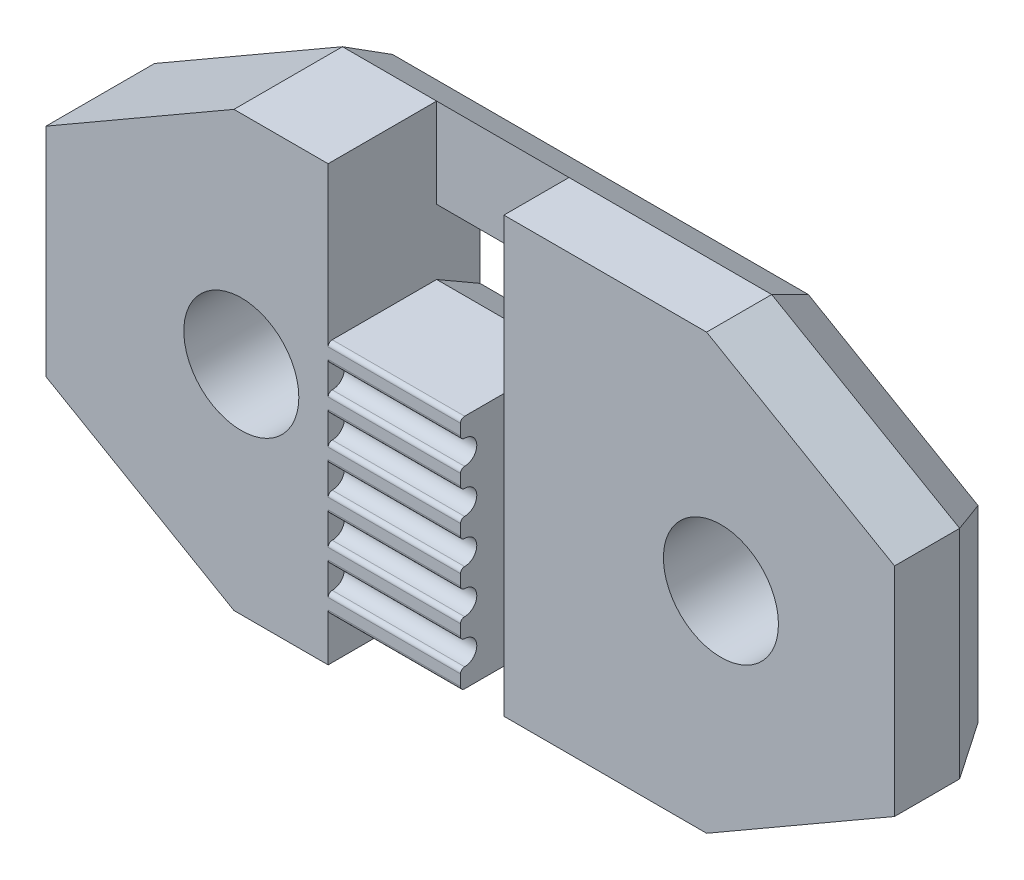
from build123d import *
from OCP.BRepFilletAPI import BRepFilletAPI_MakeChamfer

# Parameters (mm, degrees)
AUFSATZ_LINEAR_AUSTRAGEN1_DEPTH    = 6.1
AUFSATZ_LINEAR_AUSTRAGEN1_2_DEPTH  = 6.1
SKIZZE2_W                          = 6
SKIZZE2_H                          = 10.88
SCHNITT_LINEAR_AUSTRAGEN1_DEPTH    = 6.1
SKIZZE3_R                          = 2.65
SKIZZE3_W                          = 6.1
SKIZZE3_H                          = 4.12
AUFSATZ_LINEAR_AUSTRAGEN2_DEPTH    = 2.19
SKIZZE4_R                          = 2.65
AUFSATZ_LINEAR_AUSTRAGEN3_DEPTH    = 4.81
SKIZZE5_R                          = 2.65
AUFSATZ_LINEAR_AUSTRAGEN4_DEPTH    = 0.19
FASE1_SIZE                         = 5
FASE1_SIZE2                        = 8.660254038
FASE2_SIZE                         = 2
FASE2_SIZE2                        = 1.154700538
SCHNITT_LINEAR_START               = -4
SCHNITT_LINEAR_AUSTRAGEN3_DEPTH    = 2.5
SCHNITT_LINEAR_AUSTRAGEN4_REACH    = 67.9
SKIZZE12_W                         = 5
SKIZZE12_H                         = 6.1
K_RPER_VERSCHIEBEN_KOPIEREN1_ANGLE = 90


with BuildPart() as part:
    # Skizze1 → Aufsatz-Linear austragen1 (new body)
    with BuildSketch(Plane.XY):
        Polygon((0, 0), (0, 9.44), (0, 10.88), (-6, 10.88), (-6, 0), align=None)
    extrude(amount=AUFSATZ_LINEAR_AUSTRAGEN1_DEPTH)

    # Skizze2 → Schnitt-Linear austragen1 (cut)
    with BuildSketch(Plane.XY.offset(6.1)):
        with Locations((-3, 5.44)):
            Rectangle(SKIZZE2_W, SKIZZE2_H)
    extrude(amount=-SCHNITT_LINEAR_AUSTRAGEN1_DEPTH, mode=Mode.SUBTRACT)


with BuildPart() as body_2:
    # Skizze1 → Aufsatz-Linear austragen1 2 (new body)
    with BuildSketch(Plane.XY):
        with BuildLine():
            Line((-7.05, 10.19), (-7.05, 10.69))
            ThreePointArc((-7.05, 10.69), (-7.105649712, 10.824350288), (-7.24, 10.88))
            Line((-7.24, 10.88), (-9.24, 10.88))
            Line((-9.24, 10.88), (-9.24, 0))
            Line((-9.24, 0), (-7.24, 0))
            ThreePointArc((-7.24, 0), (-7.105649712, 0.055649712), (-7.05, 0.19))
            Line((-7.05, 0.19), (-7.05, 0.69))
            ThreePointArc((-7.05, 0.69), (-7.105649712, 0.824350288), (-7.24, 0.88))
            ThreePointArc((-7.24, 0.88), (-7.8, 1.44), (-7.24, 2))
            ThreePointArc((-7.24, 2), (-7.105649712, 2.055649712), (-7.05, 2.19))
            Line((-7.05, 2.19), (-7.05, 2.69))
            ThreePointArc((-7.05, 2.69), (-7.105649712, 2.824350288), (-7.24, 2.88))
            ThreePointArc((-7.24, 2.88), (-7.8, 3.44), (-7.24, 4))
            ThreePointArc((-7.24, 4), (-7.105649712, 4.055649712), (-7.05, 4.19))
            Line((-7.05, 4.19), (-7.05, 4.69))
            ThreePointArc((-7.05, 4.69), (-7.105649712, 4.824350288), (-7.24, 4.88))
            ThreePointArc((-7.24, 4.88), (-7.8, 5.44), (-7.24, 6))
            ThreePointArc((-7.24, 6), (-7.105649712, 6.055649712), (-7.05, 6.19))
            Line((-7.05, 6.19), (-7.05, 6.69))
            ThreePointArc((-7.05, 6.69), (-7.105649712, 6.824350288), (-7.24, 6.88))
            ThreePointArc((-7.24, 6.88), (-7.8, 7.44), (-7.24, 8))
            ThreePointArc((-7.24, 8), (-7.105649712, 8.055649712), (-7.05, 8.19))
            Line((-7.05, 8.19), (-7.05, 8.69))
            ThreePointArc((-7.05, 8.69), (-7.105649712, 8.824350288), (-7.24, 8.88))
            ThreePointArc((-7.24, 8.88), (-7.8, 9.44), (-7.24, 10))
            ThreePointArc((-7.24, 10), (-7.105649712, 10.055649712), (-7.05, 10.19))
        make_face()
    extrude(amount=AUFSATZ_LINEAR_AUSTRAGEN1_2_DEPTH)

    # Skizze3 → Aufsatz-Linear austragen2 (add)
    # profile 1 of 2: a face of its own
    with BuildSketch(Plane.ZY.offset(9.24)):
        Polygon((-13, -2), (0, -2), (0, 13.88), (0, 18), (-13, 18), align=None)
        with Locations((-4, 8)):
            Circle(SKIZZE3_R, mode=Mode.SUBTRACT)
    # profile 2 of 2: a face of its own
    with BuildSketch(Plane.ZY.offset(9.24)):
        with Locations((3.05, 15.94)):
            Rectangle(SKIZZE3_W, SKIZZE3_H)
    extrude(amount=-AUFSATZ_LINEAR_AUSTRAGEN2_DEPTH)

    # Skizze4 → Aufsatz-Linear austragen3 (add)
    # profile 1 of 2: a face of its own
    with BuildSketch(Plane.ZY.offset(9.24)):
        Polygon((24.1, 18), (6.1, 18), (6.1, 13.88), (6.1, 10.88), (6.1, 0), (6.1, -2), (24.1, -2), align=None)
        with Locations((16.1, 8)):
            Circle(SKIZZE4_R, mode=Mode.SUBTRACT)
    # profile 2 of 2: a face of its own
    with BuildSketch(Plane.ZY.offset(9.24)):
        Polygon((6.1, 0), (6.1, 10.88), (0, 10.88), (0, 13.88), (6.1, 13.88), (6.1, 18), (-13, 18), (-13, -2), (0, -2), (0, 0), align=None)
        with Locations((-4, 8)):
            Circle(SKIZZE4_R, mode=Mode.SUBTRACT)
    extrude(amount=AUFSATZ_LINEAR_AUSTRAGEN3_DEPTH)

    # Skizze5 → Aufsatz-Linear austragen4 (add)
    with BuildSketch(Plane(origin=(-9.24, 0, 0), x_dir=(0, 0, -1), z_dir=(1, 0, 0))):
        Polygon((-6.1, 13.88), (-6.1, 18), (-24.1, 18), (-24.1, -2), (-6.1, -2), (-6.1, 0), (-6.1, 10.88), align=None)
        with Locations(Location((-16.1, 8, 0), (0, 0, 180))):
            Circle(SKIZZE5_R, mode=Mode.SUBTRACT)
    extrude(amount=AUFSATZ_LINEAR_AUSTRAGEN4_DEPTH)

    # Fase1: one chamfer whose edges measure the first distance from different faces: ONE call of the kernel's chamfer builder (chamfer() names one face for all edges)
    fase1_edges_1 = [body_2.edges().sort_by_distance(p)[0] for p in [
        (-11.645, -2, 24.1),
        (-11.645, 18, 24.1),
    ]]
    fase1_side_1 = [body_2.faces().sort_by_distance(p)[0] for p in [
        (-11.645, 8, 24.1),
    ]]
    fase1_edges_2 = [body_2.edges().sort_by_distance(p)[0] for p in [
        (-10.55, -2, -13),
        (-10.55, 18, -13),
    ]]
    fase1_side_2 = [body_2.faces().sort_by_distance(p)[0] for p in [
        (-10.55, 8, -13),
    ]]
    fase1 = BRepFilletAPI_MakeChamfer(body_2.part.solid().wrapped)
    for e in fase1_edges_1:
        fase1.Add(FASE1_SIZE, FASE1_SIZE2, e.wrapped, fase1_side_1[0].wrapped)  # the first distance lies on this face
    for e in fase1_edges_2:
        fase1.Add(FASE1_SIZE, FASE1_SIZE2, e.wrapped, fase1_side_2[0].wrapped)  # the first distance lies on this face
    add(Compound.cast(fase1.Shape()), mode=Mode.REPLACE)

    # Fase2: one chamfer whose edges measure the first distance from different faces: ONE call of the kernel's chamfer builder (chamfer() names one face for all edges)
    fase2_edges_1 = [body_2.edges().sort_by_distance(p)[0] for p in [
        (-14.05, -2, 10.769872981),
    ]]
    fase2_side_1 = [body_2.faces().sort_by_distance(p)[0] for p in [
        (-11.645, -2, 10.769872981),
    ]]
    fase2_edges_2 = [body_2.edges().sort_by_distance(p)[0] for p in [
        (-14.05, 10.88, 3.05),
    ]]
    fase2_side_2 = [body_2.faces().sort_by_distance(p)[0] for p in [
        (-11.645, 10.88, 3.05),
    ]]
    fase2_edges_3 = [body_2.edges().sort_by_distance(p)[0] for p in [
        (-14.05, 13.88, 3.05),
    ]]
    fase2_side_3 = [body_2.faces().sort_by_distance(p)[0] for p in [
        (-10.55, 13.88, 3.05),
    ]]
    fase2_edges_4 = [body_2.edges().sort_by_distance(p)[0] for p in [
        (-14.05, 18, 5.55),
    ]]
    fase2_side_4 = [body_2.faces().sort_by_distance(p)[0] for p in [
        (-10.939880768, 18, 4.735948766),
    ]]
    fase2_edges_5 = [body_2.edges().sort_by_distance(p)[0] for p in [
        (-14.05, 8, 24.1),
    ]]
    fase2_side_5 = [body_2.faces().sort_by_distance(p)[0] for p in [
        (-11.645, 8, 24.1),
    ]]
    fase2_edges_6 = [body_2.edges().sort_by_distance(p)[0] for p in [
        (-14.05, 8, -13),
    ]]
    fase2_side_6 = [body_2.faces().sort_by_distance(p)[0] for p in [
        (-10.55, 8, -13),
    ]]
    fase2_edges_7 = [body_2.edges().sort_by_distance(p)[0] for p in [
        (-14.05, -2, -2.169872981),
    ]]
    fase2_side_7 = [body_2.faces().sort_by_distance(p)[0] for p in [
        (-10.55, -2, -2.169872981),
    ]]
    fase2_edges_8 = [body_2.edges().sort_by_distance(p)[0] for p in [
        (-14.05, 0.5, -8.669872981),
    ]]
    fase2_side_8 = [body_2.faces().sort_by_distance(p)[0] for p in [
        (-10.55, 0.5, -8.669872981),
    ]]
    fase2_edges_9 = [body_2.edges().sort_by_distance(p)[0] for p in [
        (-14.05, 0.5, 19.769872981),
    ]]
    fase2_side_9 = [body_2.faces().sort_by_distance(p)[0] for p in [
        (-11.645, 0.5, 19.769872981),
    ]]
    fase2_edges_10 = [body_2.edges().sort_by_distance(p)[0] for p in [
        (-14.05, 15.5, 19.769872981),
    ]]
    fase2_side_10 = [body_2.faces().sort_by_distance(p)[0] for p in [
        (-11.645, 15.5, 19.769872981),
    ]]
    fase2_edges_11 = [body_2.edges().sort_by_distance(p)[0] for p in [
        (-14.05, 15.5, -8.669872981),
    ]]
    fase2_side_11 = [body_2.faces().sort_by_distance(p)[0] for p in [
        (-10.55, 15.5, -8.669872981),
    ]]
    fase2 = BRepFilletAPI_MakeChamfer(body_2.part.solid().wrapped)
    for e in fase2_edges_1:
        fase2.Add(FASE2_SIZE, FASE2_SIZE2, e.wrapped, fase2_side_1[0].wrapped)  # the first distance lies on this face
    for e in fase2_edges_2:
        fase2.Add(FASE2_SIZE, FASE2_SIZE2, e.wrapped, fase2_side_2[0].wrapped)  # the first distance lies on this face
    for e in fase2_edges_3:
        fase2.Add(FASE2_SIZE, FASE2_SIZE2, e.wrapped, fase2_side_3[0].wrapped)  # the first distance lies on this face
    for e in fase2_edges_4:
        fase2.Add(FASE2_SIZE, FASE2_SIZE2, e.wrapped, fase2_side_4[0].wrapped)  # the first distance lies on this face
    for e in fase2_edges_5:
        fase2.Add(FASE2_SIZE, FASE2_SIZE2, e.wrapped, fase2_side_5[0].wrapped)  # the first distance lies on this face
    for e in fase2_edges_6:
        fase2.Add(FASE2_SIZE, FASE2_SIZE2, e.wrapped, fase2_side_6[0].wrapped)  # the first distance lies on this face
    for e in fase2_edges_7:
        fase2.Add(FASE2_SIZE, FASE2_SIZE2, e.wrapped, fase2_side_7[0].wrapped)  # the first distance lies on this face
    for e in fase2_edges_8:
        fase2.Add(FASE2_SIZE, FASE2_SIZE2, e.wrapped, fase2_side_8[0].wrapped)  # the first distance lies on this face
    for e in fase2_edges_9:
        fase2.Add(FASE2_SIZE, FASE2_SIZE2, e.wrapped, fase2_side_9[0].wrapped)  # the first distance lies on this face
    for e in fase2_edges_10:
        fase2.Add(FASE2_SIZE, FASE2_SIZE2, e.wrapped, fase2_side_10[0].wrapped)  # the first distance lies on this face
    for e in fase2_edges_11:
        fase2.Add(FASE2_SIZE, FASE2_SIZE2, e.wrapped, fase2_side_11[0].wrapped)  # the first distance lies on this face
    add(Compound.cast(fase2.Shape()), mode=Mode.REPLACE)

    # Skizze11 → Schnitt-Linear austragen3 (cut)
    with BuildSketch(Plane.XZ.offset(2).offset(SCHNITT_LINEAR_START)):
        with BuildLine():
            Line((-14.05, 7.6), (-14.05, 6.1))
            ThreePointArc((-14.05, 6.1), (-12.989339828, 5.660660172), (-12.55, 4.6))
            Line((-12.55, 4.6), (-12.55, 1.5))
            ThreePointArc((-12.55, 1.5), (-12.989339828, 0.439339828), (-14.05, 0))
            Line((-14.05, 0), (-14.05, -1.5))
            ThreePointArc((-14.05, -1.5), (-11.928679656, -0.621320344), (-11.05, 1.5))
            Line((-11.05, 1.5), (-11.05, 4.6))
            ThreePointArc((-11.05, 4.6), (-11.928679656, 6.721320344), (-14.05, 7.6))
        make_face()
    extrude(amount=-SCHNITT_LINEAR_AUSTRAGEN3_DEPTH, mode=Mode.SUBTRACT)


with BuildPart() as body_2_2:
    # Spiegeln1: mirrored copy
    add(body_2.part.mirror(Plane(origin=(-63.197479165, -24.924466517, 24.1), x_dir=(1, 0, 0), z_dir=(0, 0, 1))))

    # Schnitt-Linear austragen4: up to this plane
    schnitt_linear_austragen4_end = Plane(origin=(-14.05, 15.034700538, 42.1), z_dir=(0.4999999999999981, 0.8660254037844397, 0))
    # Skizze12 → Schnitt-Linear austragen4 (cut, up to the surface)
    with BuildSketch(Plane(origin=(0, 18, 0), x_dir=(1, 0, 0), z_dir=(0, 1, 0)), mode=Mode.PRIVATE) as schnitt_linear_austragen4_sk1:
        with Locations((-9.55, -45.15)):
            Rectangle(SKIZZE12_W, SKIZZE12_H)
    schnitt_linear_austragen4_tool1 = split(extrude(schnitt_linear_austragen4_sk1.sketch, amount=-SCHNITT_LINEAR_AUSTRAGEN4_REACH, mode=Mode.PRIVATE), bisect_by=schnitt_linear_austragen4_end, keep=Keep.BOTH, mode=Mode.PRIVATE)
    add(schnitt_linear_austragen4_tool1.solids().sort_by_distance((-9.55, 18, 45.15))[0], mode=Mode.SUBTRACT)


with BuildPart() as body_2_2_1:
    # Körper-Verschieben/Kopieren1: moved
    add(body_2_2.part.rotate(Axis((-10.55, 0, 42.65), (0, -1, 0)), K_RPER_VERSCHIEBEN_KOPIEREN1_ANGLE))


solid = body_2_2_1.part
